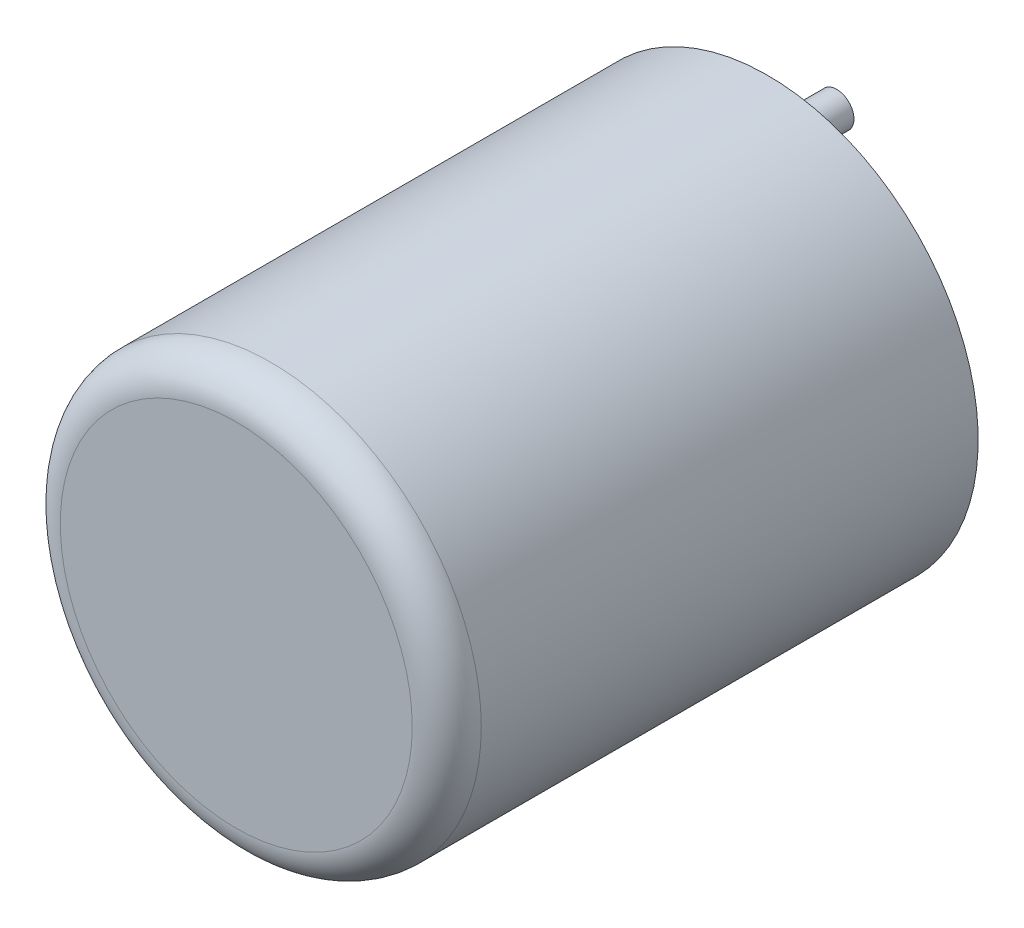
from build123d import *

# Parameters (mm, degrees)
SKETCH_1_R          = 12.2
EXTRUDE_1_DEPTH     = 30.8
FILLET_1_R          = 2
SKETCH_2_R          = 3.25
EXTRUDE_2_DEPTH     = 1.7
SKETCH_5_R          = 1
EXTRUDE_4_DEPTH     = 4
SKETCH_7_W          = 1.851248616
SKETCH_7_H          = 0.354328631
CUT_EXTRUDE_1_DEPTH = 1
SKETCH_8_W          = 0.317488429
SKETCH_8_H          = 1.793967755
CUT_EXTRUDE_2_DEPTH = 1
SKETCH_10_W         = 0.364887613
SKETCH_10_H         = 1.860802793
CUT_EXTRUDE_4_DEPTH = 1
SKETCH_11_W         = 1.9755237
SKETCH_11_H         = 0.380671715
CUT_EXTRUDE_5_DEPTH = 1


with BuildPart() as part:
    # 草图1 → 凸台-拉伸1 (new body)
    with BuildSketch(Plane.XY):
        with Locations(Location((0, 0, 0), (0, 0, 180))):
            Circle(SKETCH_1_R)
    extrude(amount=EXTRUDE_1_DEPTH)

    # 圆角1
    fillet_1_edges = [part.edges().sort_by_distance(p)[0] for p in [
        (12.2, 0, 30.8),
    ]]
    fillet(fillet_1_edges, radius=FILLET_1_R)

    # 草图2 → 凸台-拉伸2 (add)
    with BuildSketch(Plane(origin=(0, 0, 0), x_dir=(-1, 0, 0), z_dir=(0, 0, -1))):
        Circle(SKETCH_2_R)
    extrude(amount=EXTRUDE_2_DEPTH)

    # 草图5 → 凸台-拉伸4 (add)
    with BuildSketch(Plane(origin=(0, 0, 0), x_dir=(-1, 0, 0), z_dir=(0, 0, -1))):
        with Locations(Location((0, -8.5, 0), (0, 0, 180))):
            Circle(SKETCH_5_R)
        with Locations(Location((0, 8.5, 0), (0, 0, 180))):
            Circle(SKETCH_5_R)
    extrude(amount=EXTRUDE_4_DEPTH)

    # 草图7 → 切除-拉伸1 (cut)
    with BuildSketch(Plane(origin=(0, 0, 0), x_dir=(-1, 0, 0), z_dir=(0, 0, -1))):
        with Locations((-8.515796524, 0.01329556)):
            Rectangle(SKETCH_7_W, SKETCH_7_H)
    extrude(amount=-CUT_EXTRUDE_1_DEPTH, mode=Mode.SUBTRACT)

    # 草图8 → 切除-拉伸2 (cut)
    with BuildSketch(Plane(origin=(0, 0, 0), x_dir=(-1, 0, 0), z_dir=(0, 0, -1))):
        with Locations((-8.493083651, -0.013515685)):
            Rectangle(SKETCH_8_W, SKETCH_8_H)
    extrude(amount=-CUT_EXTRUDE_2_DEPTH, mode=Mode.SUBTRACT)

    # 草图10 → 切除-拉伸4 (cut)
    with BuildSketch(Plane(origin=(0, 0, 0), x_dir=(-1, 0, 0), z_dir=(0, 0, -1))):
        with Locations((8.376136345, -0.021771447)):
            Rectangle(SKETCH_10_W, SKETCH_10_H)
    extrude(amount=-CUT_EXTRUDE_4_DEPTH, mode=Mode.SUBTRACT)

    # 草图11 → 切除-拉伸5 (cut)
    with BuildSketch(Plane(origin=(0, 0, 0), x_dir=(-1, 0, 0), z_dir=(0, 0, -1))):
        with Locations((8.368475893, -0.042969493)):
            Rectangle(SKETCH_11_W, SKETCH_11_H)
    extrude(amount=-CUT_EXTRUDE_5_DEPTH, mode=Mode.SUBTRACT)


solid = part.part
